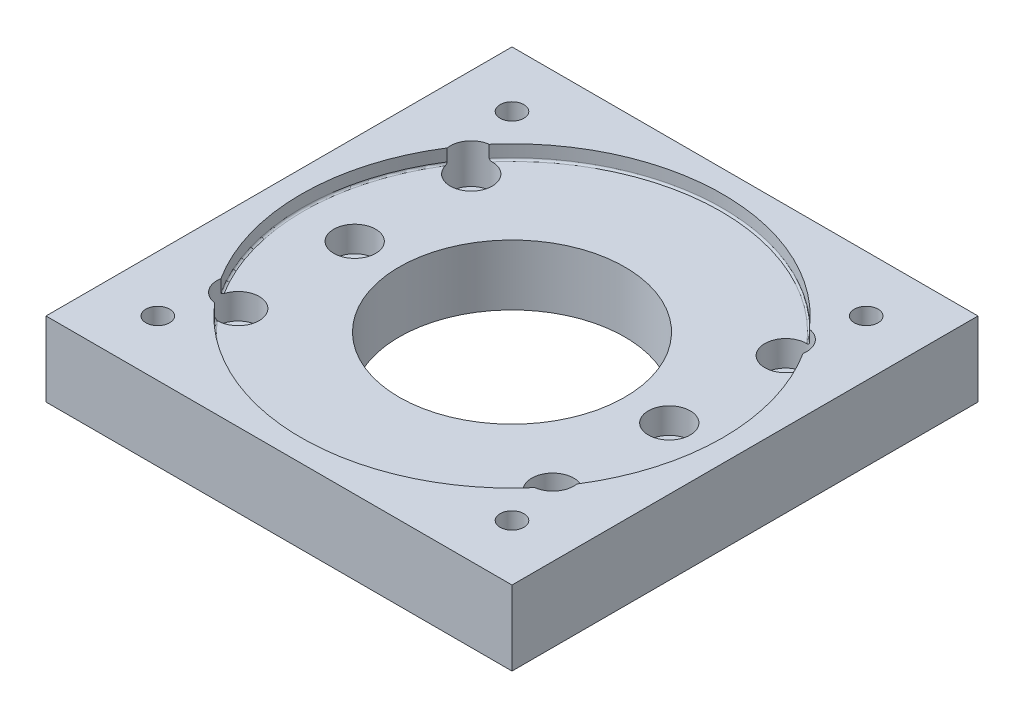
from build123d import *

# Parameters (mm, degrees)
SKETCH1_W                                            = 200
SKETCH1_H                                            = 200
BOSS_EXTRUDE1_DEPTH                                  = 19.05
SKETCH2_W                                            = 200
SKETCH2_H                                            = 3.05
CUT_EXTRUDE1_DEPTH                                   = 225.416805298
SKETCH3_R                                            = 90.5
CUT_EXTRUDE2_DEPTH                                   = 6
M12_TAPPED_HOLE1_D                                   = 10.2
M12_TAPPED_HOLE1_DEPTH                               = 32.75
M12_TAPPED_HOLE1_TIP                                 = 3.064389157
SKETCH6_R                                            = 48.41875
CUT_EXTRUDE3_DEPTH                                   = 144.791515744
FILLET1_R                                            = 0.79375
CBORE_FOR_M10_HEX_SOCKET_HEAD_CAP_SCREW1_D           = 11
CBORE_FOR_M10_HEX_SOCKET_HEAD_CAP_SCREW1_CBORE_D     = 18
CBORE_FOR_M10_HEX_SOCKET_HEAD_CAP_SCREW1_CBORE_DEPTH = 17


with BuildPart() as part:
    # Sketch1 → Boss-Extrude1 (new, symmetric)
    with BuildSketch(Plane(origin=(0, 0, 0), x_dir=(1, 0, 0), z_dir=(0, 1, 0))):
        Rectangle(SKETCH1_W, SKETCH1_H)
    extrude(amount=BOSS_EXTRUDE1_DEPTH, both=True)

    # Sketch2 → Cut-Extrude1 (cut, through all)
    with BuildSketch(Plane.XY.offset(100)):
        with Locations((0, 17.525)):
            Rectangle(SKETCH2_W, SKETCH2_H)
        with Locations((0, -17.525)):
            Rectangle(SKETCH2_W, SKETCH2_H)
    extrude(amount=-CUT_EXTRUDE1_DEPTH, mode=Mode.SUBTRACT)

    # Sketch3 → Cut-Extrude2 (cut)
    with BuildSketch(Plane(origin=(0, 16, 0), x_dir=(1, 0, 0), z_dir=(0, 1, 0))):
        with Locations(Location((0, 0, 0), (0, 0, 270))):
            Circle(SKETCH3_R)
    extrude(amount=-CUT_EXTRUDE2_DEPTH, mode=Mode.SUBTRACT)

    # M12 Tapped Hole1
    with Locations(Plane(origin=(0, 16, 0), x_dir=(1, 0, 0), z_dir=(0, 1, 0))):
        with Locations((-76.013978978, 76.013978978), (76.013978978, 76.013978978), (76.013978978, -76.013978978), (-76.013978978, -76.013978978)):
            Hole(M12_TAPPED_HOLE1_D / 2, depth=M12_TAPPED_HOLE1_DEPTH)
            with Locations((0, 0, -(M12_TAPPED_HOLE1_DEPTH + M12_TAPPED_HOLE1_TIP / 2))):  # 118° drill point
                Cone(0, M12_TAPPED_HOLE1_D / 2, M12_TAPPED_HOLE1_TIP, mode=Mode.SUBTRACT)

    # Sketch6 → Cut-Extrude3 (cut, through all)
    with BuildSketch(Plane(origin=(0, 10, 0), x_dir=(1, 0, 0), z_dir=(0, 1, 0))):
        with Locations(Location((0, 0, 0), (0, 0, 270))):
            Circle(SKETCH6_R)
    extrude(amount=-CUT_EXTRUDE3_DEPTH, mode=Mode.SUBTRACT)

    # Fillet1
    fillet1_edges = [part.edges().sort_by_distance(p)[0] for p in [
        (0, 10, -90.5),
    ]]
    fillet(fillet1_edges, radius=FILLET1_R)

    # CBORE for M10 Hex Socket Head Cap Screw1 (through all)
    with Locations(Plane(origin=(0, 16, 0), x_dir=(1, 0, 0), z_dir=(0, 1, 0))):
        with Locations((-67.5, -50), (-67.5, 0), (-67.5, 50), (67.5, 50), (67.5, 0), (67.5, -50)):
            CounterBoreHole(CBORE_FOR_M10_HEX_SOCKET_HEAD_CAP_SCREW1_D / 2, CBORE_FOR_M10_HEX_SOCKET_HEAD_CAP_SCREW1_CBORE_D / 2, CBORE_FOR_M10_HEX_SOCKET_HEAD_CAP_SCREW1_CBORE_DEPTH)


solid = part.part
